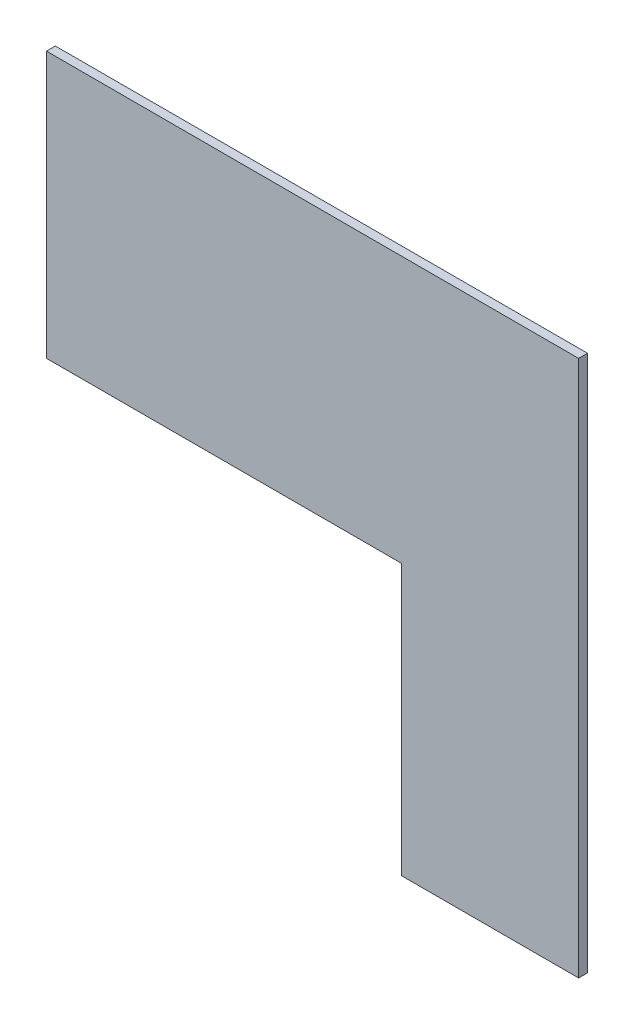
from build123d import *

# Parameters (mm, degrees)
BOSS_EXTRU_1_DEPTH = 20


with BuildPart() as part:
    # Esquisse1 → Boss.-Extru.1 (new body)
    with BuildSketch(Plane.XY):
        Polygon((0, 0), (0, 600), (1200, 600), (1200, -610), (800, -610), (800, 0), align=None)
    extrude(amount=BOSS_EXTRU_1_DEPTH)


solid = part.part
